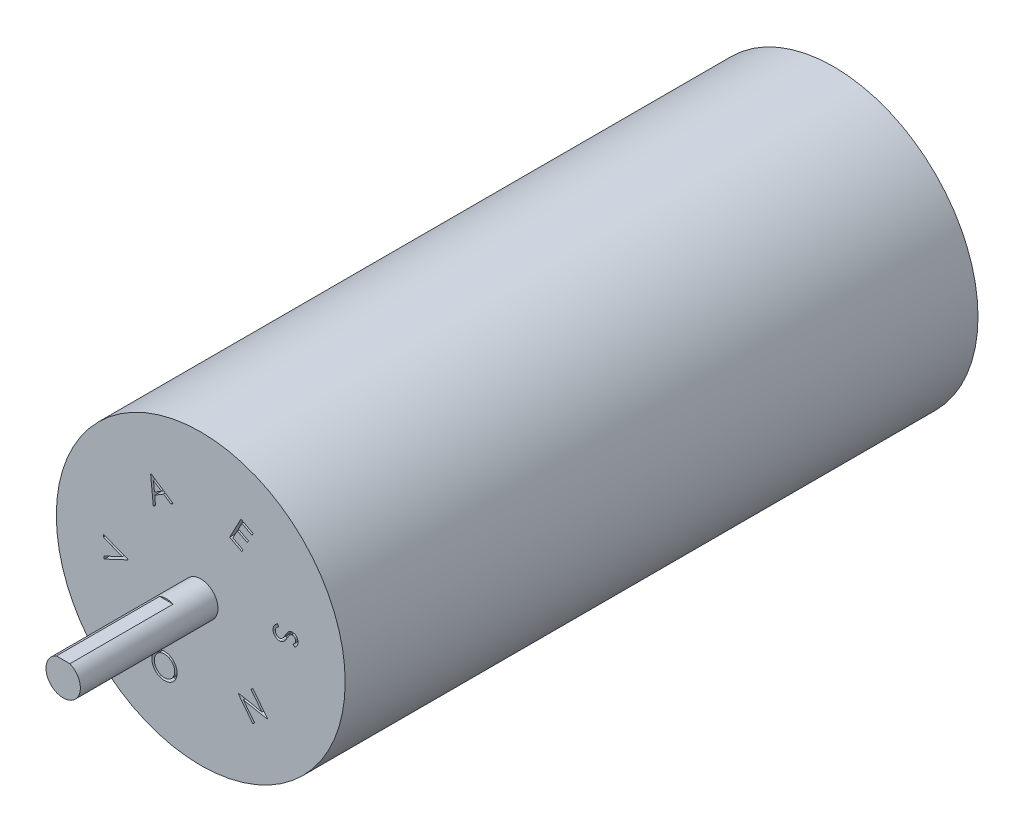
from build123d import *

# Parameters (mm, degrees)
ESBO_O1_R                = 21
RESSALTO_EXTRUS_O1_DEPTH = 92
ESBO_O2_R                = 2.5
RESSALTO_EXTRUS_O2_DEPTH = 20
CORTE_EXTRUS_O1_START    = -15
CORTE_EXTRUS_O1_DEPTH    = 15
CORTE_EXTRUS_O2_DEPTH    = 1


with BuildPart() as part:
    # Esboço1 → Ressalto-extrusão1 (new body)
    with BuildSketch(Plane.XY):
        Circle(ESBO_O1_R)
    extrude(amount=RESSALTO_EXTRUS_O1_DEPTH)

    # Esboço2 → Ressalto-extrusão2 (add)
    with BuildSketch(Plane.XY.offset(92)):
        Circle(ESBO_O2_R)
    extrude(amount=RESSALTO_EXTRUS_O2_DEPTH)

    # Esboço3 → Corte-extrusão1 (cut)
    with BuildSketch(Plane.XY.offset(112).offset(CORTE_EXTRUS_O1_START)):
        with BuildLine():
            Line((-0.979795897, 2.3), (0.979795897, 2.3))
            ThreePointArc((0.979795897, 2.3), (0, 2.5), (-0.979795897, 2.3))
        make_face()
    extrude(amount=CORTE_EXTRUS_O1_DEPTH, mode=Mode.SUBTRACT)

    # Esboço4 → Corte-extrusão2 (cut)
    # profile 1 of 6: a face of its own
    with BuildSketch(Plane.XY.offset(92)):
        with BuildLine():
            Line((11.129935173, 2.410436251), (11.33957059, 2.137699873))
            add(Edge.make_bspline(
                [(11.33957059, 2.137699873), (11.297388606, 2.107120563), (11.216591468, 2.048547671), (11.109755998, 1.952770903), (11.020079844, 1.856694987), (10.949176306, 1.758840198), (10.895979313, 1.65992429), (10.862027688, 1.559761402), (10.843945408, 1.458403124), (10.84857317, 1.391051231), (10.850888699, 1.357351315)],
                knots=[0, 0, 0, 0, 1.292220796, 2.475173836, 3.554719761, 4.547859199, 5.466297465, 6.330171769, 7.164491603, 8, 8, 8, 8], degree=3))
            add(Edge.make_bspline(
                [(10.850888699, 1.357351315), (10.855082534, 1.328925046), (10.863414076, 1.272452953), (10.888484464, 1.190719223), (10.92320947, 1.112860004), (10.967007614, 1.039708429), (11.018922966, 0.973532041), (11.077951441, 0.91680622), (11.142047997, 0.869169741), (11.211731648, 0.832224353), (11.284535522, 0.804712795), (11.359092192, 0.787885005), (11.434648628, 0.781074169), (11.484710078, 0.784773535), (11.509943186, 0.786638174)],
                knots=[0, 0, 0, 0, 1.065809564, 2.117354811, 3.162433811, 4.22512945, 5.275563902, 6.276015992, 7.25673726, 8.231295254, 9.195246186, 10.138463717, 11.061706248, 12, 12, 12, 12], degree=3))
            add(Edge.make_bspline(
                [(11.509943186, 0.786638174), (11.538730255, 0.791186828), (11.597055244, 0.800402779), (11.680724545, 0.834323436), (11.762250623, 0.880943795), (11.811303043, 0.921841756), (11.836665942, 0.942988334)],
                knots=[0, 0, 0, 0, 0.947919529, 1.920563519, 2.924812721, 4, 4, 4, 4], degree=3))
            add(Edge.make_bspline(
                [(11.836665942, 0.942988334), (11.854904663, 0.959804855), (11.893090634, 0.995013201), (11.948303904, 1.05564177), (12.006642635, 1.123948966), (12.065566903, 1.202111103), (12.127696119, 1.287845673), (12.191447319, 1.382458735), (12.2563066, 1.486546229), (12.299969261, 1.558983148), (12.322543346, 1.596433847)],
                knots=[0, 0, 0, 0, 0.728288755, 1.52480069, 2.406301695, 3.365927526, 4.398441808, 5.515935497, 6.715710786, 8, 8, 8, 8], degree=3))
            add(Edge.make_bspline(
                [(12.322543346, 1.596433847), (12.34488424, 1.633651916), (12.387587358, 1.704791756), (12.450166369, 1.805642472), (12.507019789, 1.89660538), (12.561327169, 1.975169628), (12.609387164, 2.044206885), (12.654424735, 2.101268054), (12.693638022, 2.148811825), (12.720128231, 2.175030037), (12.731998474, 2.186778398)],
                knots=[0, 0, 0, 0, 1.446723332, 2.765314562, 3.95594701, 5.02105195, 5.94826545, 6.758495696, 7.443682806, 8, 8, 8, 8], degree=3))
            add(Edge.make_bspline(
                [(12.731998474, 2.186778398), (12.750700897, 2.203641356), (12.787739457, 2.23703701), (12.846467157, 2.281721666), (12.907275072, 2.320978688), (12.970397313, 2.353190521), (13.034478344, 2.382401483), (13.101337616, 2.403238637), (13.169489274, 2.421092671), (13.216144516, 2.427064178), (13.239610654, 2.430067661)],
                knots=[0, 0, 0, 0, 1.054314312, 2.087979884, 3.08719356, 4.081023191, 5.054003657, 6.032140128, 7.010227622, 8, 8, 8, 8], degree=3))
            add(Edge.make_bspline(
                [(13.239610654, 2.430067661), (13.276521629, 2.432947458), (13.349239409, 2.438620904), (13.45754129, 2.429574696), (13.562293488, 2.407207413), (13.662513148, 2.370330274), (13.757451587, 2.321860733), (13.843705851, 2.259159156), (13.921473128, 2.184840185), (13.989842105, 2.09936265), (14.047751926, 2.005139939), (14.093893269, 1.904040541), (14.126632113, 1.79668602), (14.137740038, 1.722358265), (14.143356647, 1.684775193)],
                knots=[0, 0, 0, 0, 1.018963986, 2.007446241, 2.982725185, 3.962777813, 4.94223765, 5.911115096, 6.890574933, 7.898486478, 8.91919962, 9.930931749, 10.953796712, 12, 12, 12, 12], degree=3))
            add(Edge.make_bspline(
                [(14.143356647, 1.684775193), (14.146245685, 1.644595904), (14.151978681, 1.564864257), (14.1425327, 1.445171646), (14.116801623, 1.327930002), (14.082915205, 1.232071761), (14.046788431, 1.156231555), (14.013455503, 1.097310719), (13.973248921, 1.037568276), (13.927718312, 0.975350695), (13.874838292, 0.912737559), (13.816353307, 0.847998647), (13.752249099, 0.78135384), (13.705833115, 0.738045199), (13.682018506, 0.715824873)],
                knots=[0, 0, 0, 0, 1.294655237, 2.569109472, 3.846266781, 5.14712976, 5.829864123, 6.54704615, 7.322809512, 8.145403185, 9.026274785, 9.95792536, 10.952274542, 12, 12, 12, 12], degree=3))
            Line((13.682018506, 0.715824873), (13.435924756, 0.973136571))
            add(Edge.make_bspline(
                [(13.435924756, 0.973136571), (13.454717637, 0.991267684), (13.491114172, 1.02638256), (13.542135637, 1.078712085), (13.587737419, 1.128712858), (13.62873416, 1.175488401), (13.66398926, 1.220331918), (13.693315501, 1.263205982), (13.718266591, 1.303250003), (13.744360032, 1.353244017), (13.767632258, 1.416160098), (13.78558408, 1.492933986), (13.791974377, 1.571871874), (13.788330019, 1.624491295), (13.786485654, 1.651121347)],
                knots=[0, 0, 0, 0, 1.181448521, 2.288134203, 3.305984883, 4.243019686, 5.101792418, 5.884908674, 6.592179774, 7.235369036, 8.433357889, 9.615846959, 10.79340897, 12, 12, 12, 12], degree=3))
            add(Edge.make_bspline(
                [(13.786485654, 1.651121347), (13.781470595, 1.684393854), (13.771765387, 1.748783253), (13.736321298, 1.837625403), (13.687349565, 1.915721331), (13.623060208, 1.979560638), (13.550088217, 2.030328817), (13.469477736, 2.064318294), (13.382969853, 2.08046605), (13.324249277, 2.076580687), (13.294298154, 2.074598911)],
                knots=[0, 0, 0, 0, 1.109462991, 2.147047568, 3.137483786, 4.137521549, 5.121423757, 6.060096042, 7.010529061, 8, 8, 8, 8], degree=3))
            add(Edge.make_bspline(
                [(13.294298154, 2.074598911), (13.275763144, 2.071946046), (13.238751046, 2.066648607), (13.184337341, 2.051736114), (13.131668869, 2.030346537), (13.079550042, 2.003605755), (13.028068998, 1.968219686), (12.976263976, 1.92349912), (12.922633467, 1.869237111), (12.888705708, 1.827873967), (12.87082059, 1.806069264)],
                knots=[0, 0, 0, 0, 0.870205874, 1.737692349, 2.615669581, 3.510176149, 4.456785496, 5.513101786, 6.689024299, 8, 8, 8, 8], degree=3))
            add(Edge.make_bspline(
                [(12.87082059, 1.806069264), (12.865187162, 1.798140677), (12.851557021, 1.778957375), (12.828462153, 1.744859318), (12.800785567, 1.699449044), (12.766151078, 1.644519077), (12.727129191, 1.578317522), (12.682530905, 1.50183307), (12.630726177, 1.415765527), (12.59561161, 1.354158622), (12.577050558, 1.321594103)],
                knots=[0, 0, 0, 0, 0.411872235, 0.996529412, 1.743448508, 2.663465192, 3.746324232, 4.997263397, 6.412796922, 8, 8, 8, 8], degree=3))
            add(Edge.make_bspline(
                [(12.577050558, 1.321594103), (12.554173482, 1.282407442), (12.509949081, 1.206654462), (12.441455602, 1.099150128), (12.37515337, 1.000259621), (12.310057313, 0.910150488), (12.245632431, 0.829484504), (12.182317535, 0.757795097), (12.121204699, 0.69432897), (12.041563272, 0.624365694), (11.94186456, 0.551268414), (11.817479312, 0.483785401), (11.689928181, 0.43630173), (11.602357651, 0.422081014), (11.559021712, 0.415043623)],
                knots=[0, 0, 0, 0, 1.153891387, 2.230624125, 3.241146332, 4.181537004, 5.056866629, 5.865375282, 6.613517701, 7.295664309, 8.559423459, 9.748164583, 10.88563649, 12, 12, 12, 12], degree=3))
            add(Edge.make_bspline(
                [(11.559021712, 0.415043623), (11.528197862, 0.412233705), (11.467065114, 0.406660813), (11.375832694, 0.410766509), (11.286781888, 0.423245513), (11.199873878, 0.445289155), (11.11482637, 0.476238461), (11.031842934, 0.516307756), (10.951243465, 0.566122157), (10.873699381, 0.624215213), (10.801547475, 0.689794468), (10.735422759, 0.759926245), (10.678863187, 0.83598445), (10.629659639, 0.916469429), (10.590123149, 1.002384544), (10.557454171, 1.092550371), (10.533484212, 1.187737354), (10.524051614, 1.253246907), (10.51925809, 1.286538014)],
                knots=[0, 0, 0, 0, 0.98513604, 1.953814156, 2.901518032, 3.845998915, 4.804666667, 5.780415936, 6.776493449, 7.818914529, 8.862717498, 9.879534792, 10.884726549, 11.876928204, 12.879579641, 13.892326754, 14.928907746, 16, 16, 16, 16], degree=3))
            add(Edge.make_bspline(
                [(10.51925809, 1.286538014), (10.51676438, 1.312454923), (10.5118298, 1.363739592), (10.511309138, 1.440641821), (10.516360079, 1.516272448), (10.525940674, 1.590851876), (10.54149171, 1.66397205), (10.562483651, 1.735744754), (10.589641385, 1.805992215), (10.620893142, 1.876090383), (10.659866661, 1.944897449), (10.705588017, 2.013086617), (10.758685149, 2.080465571), (10.818204927, 2.148061145), (10.88601233, 2.214400787), (10.960255368, 2.281009279), (11.041741233, 2.347255936), (11.100023803, 2.389008364), (11.129935173, 2.410436251)],
                knots=[0, 0, 0, 0, 0.924584183, 1.829577496, 2.728111812, 3.615802582, 4.498353595, 5.381060798, 6.269217344, 7.172075516, 8.105082894, 9.074503487, 10.085924981, 11.150471663, 12.271779656, 13.453544414, 14.693125992, 16, 16, 16, 16], degree=3))
        make_face()
    # profile 2 of 6: a face of its own
    with BuildSketch(Plane.XY.offset(92)):
        Polygon((5.843652451, 12.939726056), (7.61678947, 12.005130703), (7.456232579, 11.700142722), (5.992290271, 12.472077819), (5.481873605, 11.504529742), (6.93319572, 10.738904742), (6.773339951, 10.436020126), (5.322017835, 11.201645126), (4.681893637, 9.988003299), (6.133215752, 9.222378299), (5.972658861, 8.917390319), (4.212142034, 9.845675575), align=None)
    # profile 3 of 6: a face of its own
    with BuildSketch(Plane.XY.offset(92)):
        Polygon((-7.212998929, 12.112513516), (-4.013780179, 9.955862875), (-4.336296204, 9.761652138), (-5.399897967, 10.46557842), (-6.692065435, 9.688735471), (-6.567265756, 8.421107266), (-6.901700852, 8.219885311), (-7.286616717, 12.068342843), align=None)
        Polygon((-6.867345884, 11.454861273), (-6.730627134, 10.058927779), (-5.70558707, 10.674512715), align=None, mode=Mode.SUBTRACT)
    # profile 4 of 6: a face of its own
    with BuildSketch(Plane.XY.offset(92)):
        Polygon((-14.037430063, -2.034681743), (-14.050751377, -1.656075974), (-11.399809871, -0.408780301), (-14.132081506, 0.670246141), (-14.14540282, 1.048851911), (-10.611047852, -0.343575974), (-10.608944486, -0.419297128), align=None)
    # profile 5 of 6: a face of its own
    with BuildSketch(Plane.XY.offset(92)):
        with BuildLine():
            add(Edge.make_bspline(
                [(-6.034326042, -12.774012066), (-6.092198479, -12.744960312), (-6.206131628, -12.687766283), (-6.364112194, -12.584297505), (-6.508650715, -12.470764532), (-6.638687116, -12.34535115), (-6.753294163, -12.207711493), (-6.854191482, -12.059246227), (-6.93996486, -11.898824885), (-7.010966143, -11.729105088), (-7.065082109, -11.55335666), (-7.103045122, -11.376285594), (-7.121264722, -11.199046625), (-7.121221966, -11.022161519), (-7.103221667, -10.845336386), (-7.064905758, -10.669309981), (-7.010976371, -10.49267147), (-6.960329985, -10.378742163), (-6.934566427, -10.320786906)],
                knots=[0, 0, 0, 0, 1.065151633, 2.096958159, 3.102087164, 4.086921664, 5.064622811, 6.045165415, 7.036537269, 8.053893031, 9.068685446, 10.059310649, 11.030047089, 11.995617072, 12.966353512, 13.949450922, 14.956896142, 16, 16, 16, 16], degree=3))
            add(Edge.make_bspline(
                [(-6.934566427, -10.320786906), (-6.906122578, -10.264838052), (-6.850108379, -10.154658509), (-6.749724132, -10.000920451), (-6.63731728, -9.861111874), (-6.513350516, -9.73434442), (-6.376327212, -9.622613706), (-6.227965753, -9.524095749), (-6.067456514, -9.439536296), (-5.897200145, -9.369576284), (-5.721240844, -9.315094844), (-5.543751638, -9.278227324), (-5.366633462, -9.259769997), (-5.189926294, -9.259692275), (-5.01380216, -9.278325119), (-4.838259159, -9.314131659), (-4.663201928, -9.368961404), (-4.550077986, -9.418961642), (-4.492559215, -9.444384662)],
                knots=[0, 0, 0, 0, 1.042224555, 2.052442827, 3.043928645, 4.018667415, 4.992632484, 5.975872447, 6.972878104, 8.001861446, 9.029869939, 10.028982946, 11.008812817, 11.983427836, 12.959395527, 13.946316459, 14.955788223, 16, 16, 16, 16], degree=3))
            add(Edge.make_bspline(
                [(-4.492559215, -9.444384662), (-4.435593937, -9.47292835), (-4.323645315, -9.529022634), (-4.168979292, -9.631533062), (-4.027023793, -9.743614402), (-3.899184864, -9.868449618), (-3.786126942, -10.005794069), (-3.686819231, -10.15449151), (-3.601363982, -10.314811084), (-3.531677877, -10.485080929), (-3.477093826, -10.660795191), (-3.439546665, -10.837738418), (-3.420350629, -11.01391907), (-3.419611529, -11.189213318), (-3.437259311, -11.36381317), (-3.473387848, -11.537581902), (-3.527350076, -11.710529043), (-3.576498648, -11.822083904), (-3.601433414, -11.878679534)],
                knots=[0, 0, 0, 0, 1.058484074, 2.080141361, 3.078366195, 4.062033526, 5.044595164, 6.03065391, 7.030155938, 8.059835467, 9.084827028, 10.085408485, 11.062446066, 12.026071654, 12.994573146, 13.974549982, 14.972419329, 16, 16, 16, 16], degree=3))
            add(Edge.make_bspline(
                [(-3.601433414, -11.878679534), (-3.619916194, -11.915843454), (-3.656644839, -11.989694924), (-3.719424279, -12.095790664), (-3.787839831, -12.196638776), (-3.862685459, -12.291890577), (-3.943495619, -12.381586539), (-4.029696669, -12.466563088), (-4.121825397, -12.546167988), (-4.21978209, -12.619317291), (-4.321584296, -12.686359757), (-4.426380725, -12.746314284), (-4.533719341, -12.798225471), (-4.643668057, -12.842409482), (-4.755829959, -12.880117525), (-4.871131617, -12.908289997), (-4.988566454, -12.930480762), (-5.10805862, -12.94415072), (-5.227965636, -12.950840205), (-5.347146706, -12.948160752), (-5.465053134, -12.939719394), (-5.581543574, -12.921540705), (-5.697193055, -12.897378997), (-5.81116959, -12.864188104), (-5.924117699, -12.823542863), (-5.997366874, -12.790622579), (-6.034326042, -12.774012066)],
                knots=[0, 0, 0, 0, 1.035836434, 2.058395439, 3.074577265, 4.075930666, 5.079796111, 6.086387132, 7.09567951, 8.116622952, 9.136015049, 10.136773463, 11.128289679, 12.109800777, 13.093113387, 14.079329179, 15.070244501, 16.074652265, 17.079466575, 18.065561571, 19.048597241, 20.027956052, 21.006271734, 21.995949787, 22.988820967, 24, 24, 24, 24], degree=3))
        make_face()
        with BuildLine():
            add(Edge.make_bspline(
                [(-5.903216267, -12.457806137), (-5.873968226, -12.471151493), (-5.815855323, -12.497667367), (-5.725463208, -12.528603087), (-5.634116349, -12.555087872), (-5.541037454, -12.574440294), (-5.446437653, -12.58803874), (-5.350149785, -12.594653049), (-5.252268943, -12.596519932), (-5.153437628, -12.590583501), (-5.055345665, -12.578791715), (-4.958900848, -12.561144677), (-4.86484654, -12.538270889), (-4.773258892, -12.508639565), (-4.684209497, -12.472609928), (-4.597027562, -12.4315066), (-4.512913584, -12.383546854), (-4.431444265, -12.330140735), (-4.353166123, -12.271707321), (-4.279345983, -12.207512722), (-4.209765026, -12.138676552), (-4.144678667, -12.06511961), (-4.08380783, -11.986795146), (-4.028227465, -11.903273079), (-3.975632962, -11.81570378), (-3.945478892, -11.754115381), (-3.930259536, -11.723030496)],
                knots=[0, 0, 0, 0, 0.987743045, 1.962545666, 2.933634537, 3.910130168, 4.882493923, 5.869400473, 6.875344778, 7.890000268, 8.910362884, 9.910904795, 10.902403332, 11.883934177, 12.867198945, 13.853791627, 14.844743375, 15.84109771, 16.846939383, 17.84520874, 18.846034357, 19.853773024, 20.86261236, 21.892817484, 22.936463232, 24, 24, 24, 24], degree=3))
            add(Edge.make_bspline(
                [(-3.930259536, -11.723030496), (-3.909784633, -11.676389543), (-3.86948364, -11.584585607), (-3.824312007, -11.442854989), (-3.794793086, -11.300672567), (-3.779854249, -11.15831127), (-3.779898764, -11.015684287), (-3.794742061, -10.872850789), (-3.824566749, -10.729635958), (-3.868614173, -10.588012397), (-3.924594676, -10.450672096), (-3.993063024, -10.322109677), (-4.070957372, -10.202535566), (-4.16052527, -10.093219696), (-4.261563681, -9.994124686), (-4.372513426, -9.90398234), (-4.494640061, -9.824130332), (-4.582090868, -9.779656252), (-4.626473478, -9.757084983)],
                knots=[0, 0, 0, 0, 1.052547739, 2.071742137, 3.068600106, 4.049844788, 5.025829538, 6.011880054, 7.013468945, 8.045048299, 9.074192075, 10.074906556, 11.051823696, 12.020003612, 12.990303035, 13.972772171, 14.97115115, 16, 16, 16, 16], degree=3))
            add(Edge.make_bspline(
                [(-4.626473478, -9.757084983), (-4.657183616, -9.743433846), (-4.718167765, -9.716325437), (-4.811412543, -9.68177572), (-4.90568717, -9.654531078), (-5.000737397, -9.633273841), (-5.097014826, -9.618645432), (-5.194204034, -9.60995513), (-5.292348352, -9.609060716), (-5.390694892, -9.61294878), (-5.488382818, -9.6233944), (-5.584197098, -9.640241647), (-5.677351803, -9.663471014), (-5.768499506, -9.692369186), (-5.85740225, -9.727242249), (-5.944004454, -9.768899707), (-6.027986799, -9.816615331), (-6.109396768, -9.869809515), (-6.187093503, -9.92869867), (-6.260881759, -9.992626638), (-6.33021032, -10.061255508), (-6.395063333, -10.134587433), (-6.455415038, -10.212623171), (-6.511637816, -10.295359219), (-6.56283658, -10.383150849), (-6.593225973, -10.444239743), (-6.608544792, -10.475033701)],
                knots=[0, 0, 0, 0, 1.028962778, 2.043312889, 3.042067839, 4.031756591, 5.023642214, 6.022089444, 7.016939581, 8.026912838, 9.034550776, 10.022867243, 11.003536543, 11.972225508, 12.948996343, 13.92526894, 14.912340937, 15.904794369, 16.900982085, 17.895343042, 18.89225025, 19.885941412, 20.890830964, 21.911071338, 22.947003657, 24, 24, 24, 24], degree=3))
            add(Edge.make_bspline(
                [(-6.608544792, -10.475033701), (-6.622801561, -10.50615773), (-6.651042817, -10.567811374), (-6.684809812, -10.662766443), (-6.713549816, -10.757597689), (-6.733966048, -10.853164258), (-6.750107198, -10.948761638), (-6.75810239, -11.04488549), (-6.760537448, -11.141378037), (-6.755438146, -11.237898784), (-6.744048753, -11.333600421), (-6.727790348, -11.427993946), (-6.70306162, -11.520181338), (-6.674354722, -11.611475742), (-6.637325371, -11.700367116), (-6.595233932, -11.787833655), (-6.546652636, -11.87349536), (-6.492244093, -11.957008136), (-6.4331999, -12.037437855), (-6.368793322, -12.112685093), (-6.301166523, -12.183431299), (-6.229499949, -12.248808222), (-6.153745401, -12.308878594), (-6.074209702, -12.364050579), (-5.990534778, -12.414124459), (-5.932390093, -12.443211732), (-5.903216267, -12.457806137)],
                knots=[0, 0, 0, 0, 1.052108682, 2.084123914, 3.095901837, 4.096672782, 5.086653429, 6.0748852, 7.059583681, 8.052506946, 9.043660479, 10.021887706, 10.9944239, 11.976128811, 12.962268309, 13.952144632, 14.95931889, 15.987775524, 17.015378272, 18.024729099, 19.031005754, 20.022888382, 21.004856252, 22.001516813, 22.997270294, 24, 24, 24, 24], degree=3))
        make_face(mode=Mode.SUBTRACT)
    # profile 6 of 6: a face of its own
    with BuildSketch(Plane.XY.offset(92)):
        Polygon((7.584671077, -7.532999116), (9.716782455, -10.272281969), (9.657187103, -10.318556007), (6.203461141, -9.63987011), (7.83567268, -11.736925398), (7.565740789, -11.946560815), (5.433629411, -9.207277962), (5.495328128, -9.15960168), (8.913998, -9.824966263), (7.301417872, -7.753852481), align=None)
    extrude(amount=-CORTE_EXTRUS_O2_DEPTH, mode=Mode.SUBTRACT)


solid = part.part
